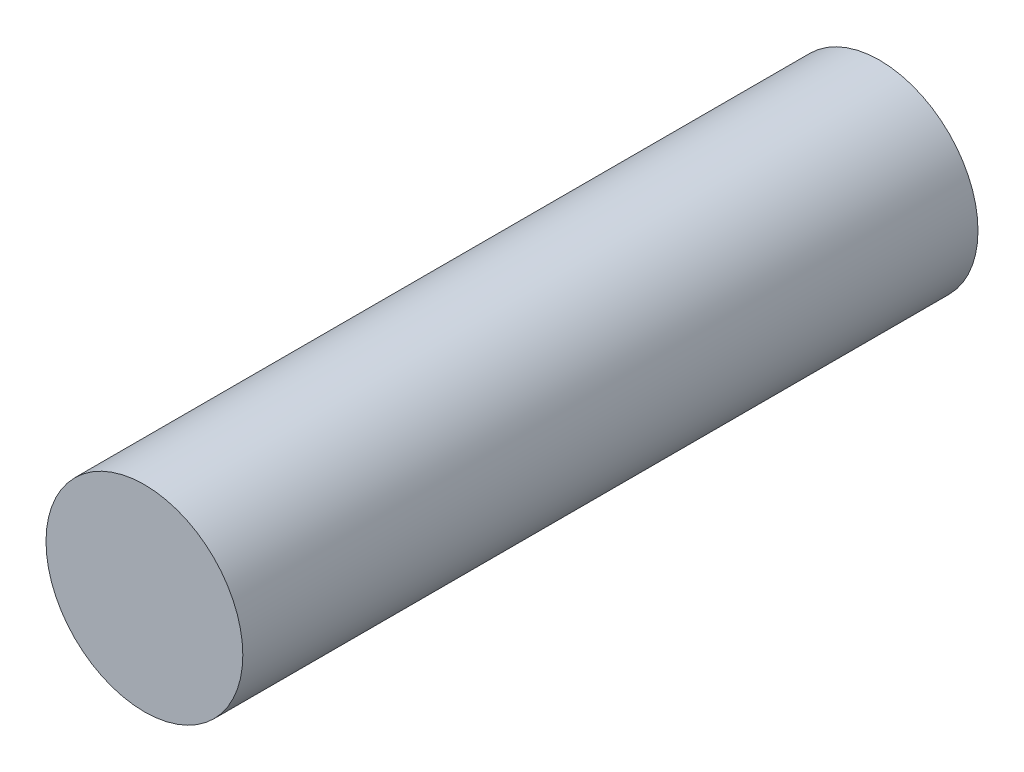
from build123d import *

# Parameters (mm, degrees)
SKETCH1_R           = 8.5
BOSS_EXTRUDE1_DEPTH = 63.5


with BuildPart() as part:
    # Sketch1 → Boss-Extrude1 (new body)
    with BuildSketch(Plane.XY):
        Circle(SKETCH1_R)
    extrude(amount=BOSS_EXTRUDE1_DEPTH)


solid = part.part
